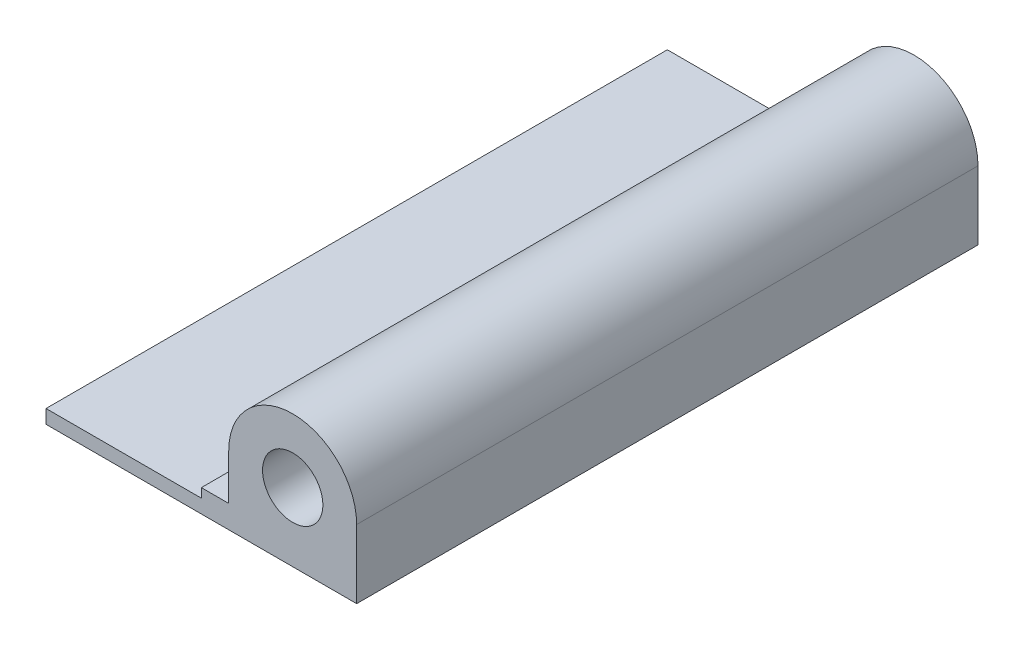
from build123d import *

# Parameters (mm, degrees)
SKETCH_1_R      = 3.3
EXTRUDE_1_DEPTH = 68


with BuildPart() as part:
    # Эскиз1 → Бобышка-Вытянуть1 (new body)
    with BuildSketch(Plane.XY.offset(68)):
        with BuildLine():
            Line((20, 7.5), (20, 2.5))
            Line((20, 2.5), (17, 2.5))
            Line((17, 2.5), (17, 1.5))
            Line((17, 1.5), (0, 1.5))
            Line((0, 1.5), (0, 0))
            Line((0, 0), (34, 0))
            Line((34, 0), (34, 7.5))
            ThreePointArc((34, 7.5), (27, 14.5), (20, 7.5))
        make_face()
        with Locations(Location((27, 7.5, 0), (0, 0, 180))):
            Circle(SKETCH_1_R, mode=Mode.SUBTRACT)
    extrude(amount=-EXTRUDE_1_DEPTH)


solid = part.part
